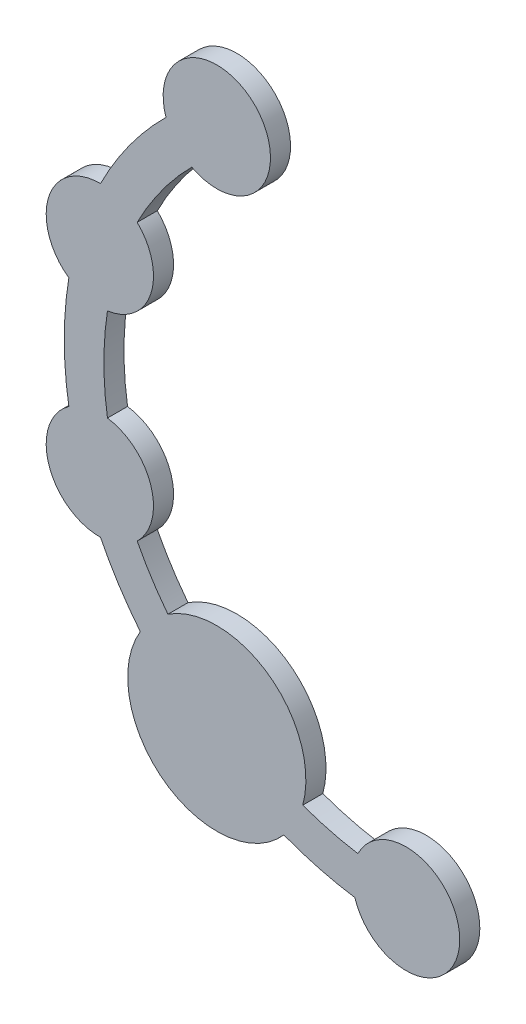
from build123d import *

# Parameters (mm, degrees)
SKETCH1_R             = 5.42
BOSS_EXTRUDE1_DEPTH   = 2.03
BOSS_EXTRUDE1_2_DEPTH = 2.03
BOSS_EXTRUDE1_3_DEPTH = 2.03
BOSS_EXTRUDE1_4_DEPTH = 2.03
BOSS_EXTRUDE1_5_DEPTH = 2.03
BOSS_EXTRUDE2_DEPTH   = 2.03
SKETCH3_R             = 9
BOSS_EXTRUDE3_DEPTH   = 2.03


with BuildPart() as part:
    # Sketch1 → Boss-Extrude1 (new body)
    with BuildSketch(Plane.XY):
        with Locations((0, -32.53)):
            Circle(SKETCH1_R)
    extrude(amount=BOSS_EXTRUDE1_DEPTH)



with BuildPart() as body_2:
    # Sketch1 → Boss-Extrude1 2 (new body)
    with BuildSketch(Plane.XY):
        with Locations((-19.120654257, -26.317322827)):
            Circle(SKETCH1_R)
    extrude(amount=BOSS_EXTRUDE1_2_DEPTH)


with BuildPart() as body_3:
    # Sketch1 → Boss-Extrude1 3 (new body)
    with BuildSketch(Plane.XY):
        with Locations((-30.937868475, -10.052322827)):
            Circle(SKETCH1_R)
    extrude(amount=BOSS_EXTRUDE1_3_DEPTH)


with BuildPart() as body_4:
    # Sketch1 → Boss-Extrude1 4 (new body)
    with BuildSketch(Plane.XY):
        with Locations((-30.937868475, 10.052322827)):
            Circle(SKETCH1_R)
    extrude(amount=BOSS_EXTRUDE1_4_DEPTH)


with BuildPart() as body_5:
    # Sketch1 → Boss-Extrude1 5 (new body)
    with BuildSketch(Plane.XY):
        with Locations((-19.120654257, 26.317322827)):
            Circle(SKETCH1_R)
    extrude(amount=BOSS_EXTRUDE1_5_DEPTH)


with BuildPart() as part_1:
    add(part.part)

    add(body_2.part)  # Boss-Extrude2 merges body 2

    add(body_3.part)  # Boss-Extrude2 merges body 3

    add(body_4.part)  # Boss-Extrude2 merges body 4

    add(body_5.part)  # Boss-Extrude2 merges body 5
    # Sketch2 → Boss-Extrude2 (add)
    with BuildSketch(Plane.XY.offset(2.03)):
        with BuildLine():
            Line((-20.296224762, 27.935356816), (-17.945083752, 24.699288838))
            ThreePointArc((-17.945083752, 24.699288838), (-29.035755442, -9.434288838), (0, -30.53))
            Line((0, -30.53), (0, -34.53))
            ThreePointArc((0, -34.53), (-32.839981508, -10.670356816), (-20.296224762, 27.935356816))
        make_face()
    extrude(amount=-BOSS_EXTRUDE2_DEPTH)

    # Sketch3 → Boss-Extrude3 (add)
    with BuildSketch(Plane.XY.offset(2.03)):
        with Locations((-19.120654257, -26.317322827)):
            Circle(SKETCH3_R)
    extrude(amount=-BOSS_EXTRUDE3_DEPTH)


solid = part_1.part
